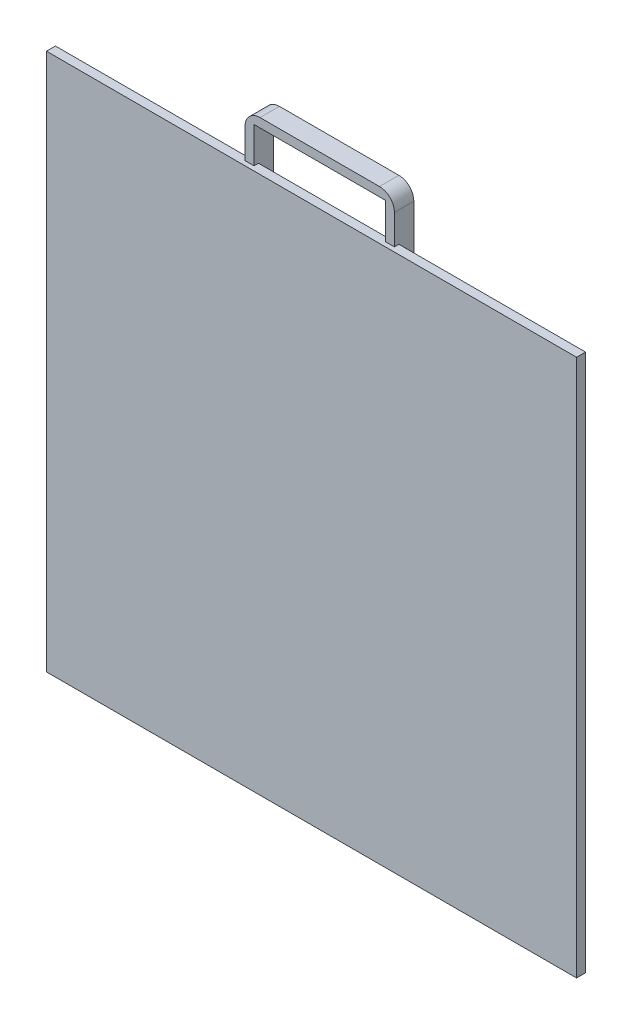
from build123d import *

# Parameters (mm, degrees)
SKETCH2_W           = 177.5
SKETCH2_H           = 180
BOSS_EXTRUDE1_DEPTH = 3
SKETCH4_W           = 50
SKETCH4_H           = 30
BOSS_EXTRUDE2_DEPTH = 6.5
CUT_EXTRUDE1_DEPTH  = 5
SKETCH6_W           = 44
SKETCH6_H           = 12
CUT_EXTRUDE2_DEPTH  = 6.5
FILLET1_R           = 5
FILLET2_R           = 5


with BuildPart() as part:
    # Sketch2 → Boss-Extrude1 (new body)
    with BuildSketch(Plane.XY):
        with Locations((88.75, 90)):
            Rectangle(SKETCH2_W, SKETCH2_H)
    extrude(amount=-BOSS_EXTRUDE1_DEPTH)

    # Sketch4 → Boss-Extrude2 (add)
    with BuildSketch(Plane.XY.offset(-1.5)):
        with Locations((90, 180)):
            Rectangle(SKETCH4_W, SKETCH4_H)
    extrude(amount=-BOSS_EXTRUDE2_DEPTH)

    # Sketch5 → Cut-Extrude1 (cut)
    with BuildSketch(Plane(origin=(0, 0, -8), x_dir=(-1, 0, 0), z_dir=(0, 0, -1))):
        Polygon((-112, 168), (-112, 165), (-68, 165), (-68, 168), (-68, 192), (-112, 192), align=None)
    extrude(amount=-CUT_EXTRUDE1_DEPTH, mode=Mode.SUBTRACT)

    # Sketch6 → Cut-Extrude2 (cut)
    with BuildSketch(Plane.XY.offset(-1.5)):
        with Locations((90, 186)):
            Rectangle(SKETCH6_W, SKETCH6_H)
    extrude(amount=-CUT_EXTRUDE2_DEPTH, mode=Mode.SUBTRACT)

    # Fillet1
    fillet1_edges = [part.edges().sort_by_distance(p)[0] for p in [
        (115, 195, -4.75),
    ]]
    fillet(fillet1_edges, radius=FILLET1_R)

    # Fillet2
    fillet2_edges = [part.edges().sort_by_distance(p)[0] for p in [
        (65, 195, -4.75),
    ]]
    fillet(fillet2_edges, radius=FILLET2_R)


solid = part.part
